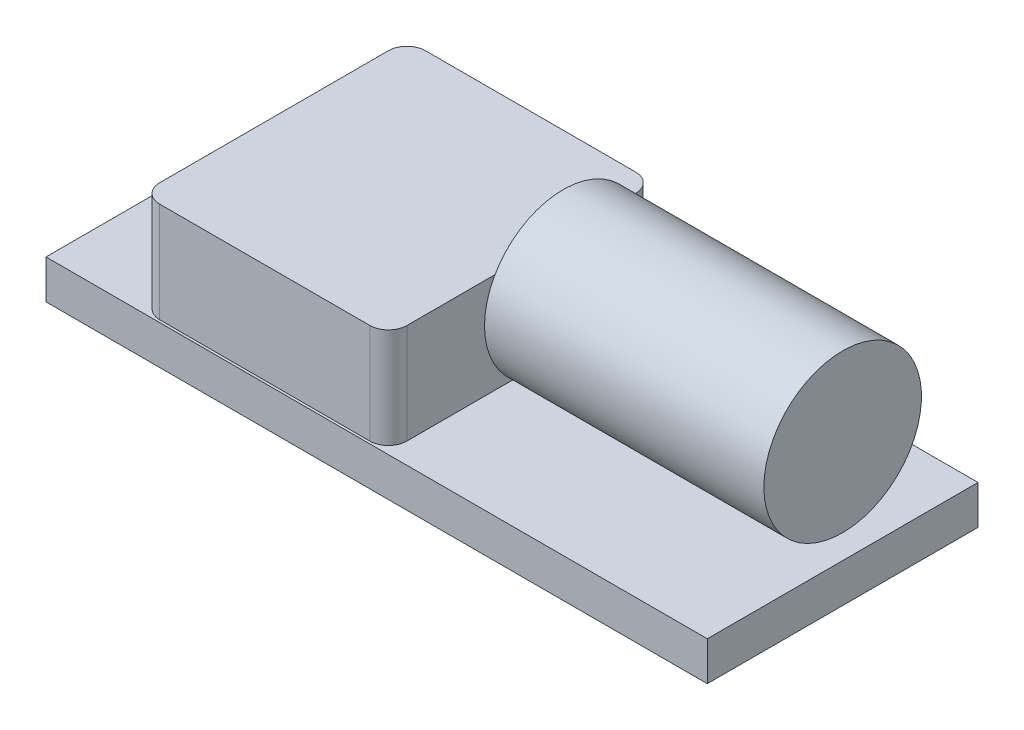
from build123d import *

# Parameters (mm, degrees)
SKETCH1_W           = 27.178
SKETCH1_H           = 11.1252
BOSS_EXTRUDE1_DEPTH = 1.6002
BOSS_EXTRUDE2_DEPTH = 4.1148
SKETCH3_W           = 11.4808
SKETCH3_H           = 3.2385


with BuildPart() as part:
    # Sketch1 → Boss-Extrude1 (new body)
    with BuildSketch(Plane(origin=(0, 0, 0), x_dir=(1, 0, 0), z_dir=(0, 1, 0))):
        Rectangle(SKETCH1_W, SKETCH1_H)
    extrude(amount=-BOSS_EXTRUDE1_DEPTH)

    # Sketch2 → Boss-Extrude2 (add)
    with BuildSketch(Plane(origin=(0, 0, 0), x_dir=(1, 0, 0), z_dir=(0, 1, 0))):
        with BuildLine():
            Line((-9.017, -5.461), (-0.381, -5.461))
            ThreePointArc((-0.381, -5.461), (0.157815367, -5.237815367), (0.381, -4.699))
            Line((0.381, -4.699), (0.381, 4.699))
            ThreePointArc((0.381, 4.699), (0.157815367, 5.237815367), (-0.381, 5.461))
            Line((-0.381, 5.461), (-9.017, 5.461))
            ThreePointArc((-9.017, 5.461), (-9.555815367, 5.237815367), (-9.779, 4.699))
            Line((-9.779, 4.699), (-9.779, -4.699))
            ThreePointArc((-9.779, -4.699), (-9.555815367, -5.237815367), (-9.017, -5.461))
        make_face()
    extrude(amount=BOSS_EXTRUDE2_DEPTH)


with BuildPart() as body_2:
    # Sketch3 → Revolve1 (revolve)
    with BuildSketch(Plane.XY, mode=Mode.PRIVATE) as revolve1_sk:
        with Locations((7.8486, 5.84835)):
            Rectangle(SKETCH3_W, SKETCH3_H)
    revolve(revolve1_sk.sketch.rotate(Axis((2.1082, 4.2291, 0), (1, 0, 0)), 90), axis=Axis((2.1082, 4.2291, 0), (1, 0, 0)))


solid = Compound([part.part, body_2.part])
